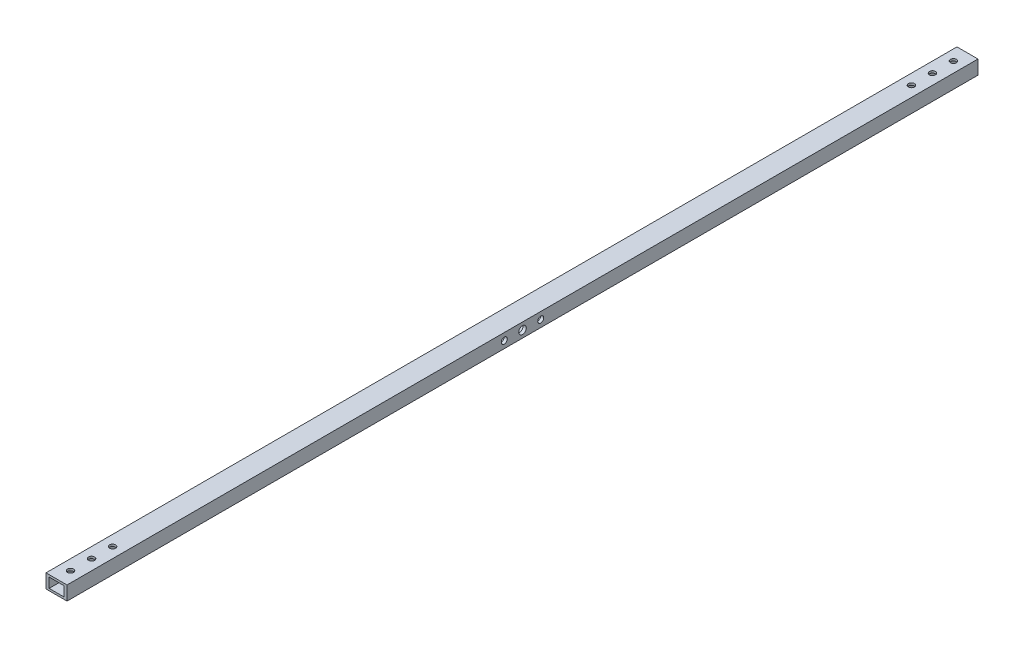
from build123d import *

# Parameters (mm, degrees)
SKETCH_1_W          = 15
SKETCH_1_H          = 10
SKETCH_1_W_2        = 10.5
SKETCH_1_H_2        = 7
EXTRUDE_1_DEPTH     = 650
SKETCH_2_R          = 2.15
CUT_EXTRUDE_1_DEPTH = 651.120181197
SKETCH_3_R          = 2.15
SKETCH_3_R_2        = 2.7
CUT_EXTRUDE_2_DEPTH = 651.192279253


with BuildPart() as part:
    # 草图1 → 凸台-拉伸1 (new body)
    with BuildSketch(Plane.XY):
        Rectangle(SKETCH_1_W, SKETCH_1_H)
        Rectangle(SKETCH_1_W_2, SKETCH_1_H_2, mode=Mode.SUBTRACT)
    extrude(amount=EXTRUDE_1_DEPTH)

    # 草图2 → 切除-拉伸1 (cut, through all)
    with BuildSketch(Plane.XZ.offset(5)):
        with Locations(Location((0, 640, 0), (0, 0, 270))):
            Circle(SKETCH_2_R)
        with Locations(Location((0, 625, 0), (0, 0, 270))):
            Circle(SKETCH_2_R)
        with Locations(Location((0, 610, 0), (0, 0, 270))):
            Circle(SKETCH_2_R)
        with Locations(Location((0, 10, 0), (0, 0, 270))):
            Circle(SKETCH_2_R)
        with Locations(Location((0, 25, 0), (0, 0, 270))):
            Circle(SKETCH_2_R)
        with Locations(Location((0, 40, 0), (0, 0, 270))):
            Circle(SKETCH_2_R)
    extrude(amount=-CUT_EXTRUDE_1_DEPTH, mode=Mode.SUBTRACT)

    # 草图3 → 切除-拉伸2 (cut, through all)
    with BuildSketch(Plane(origin=(7.5, 0, 0), x_dir=(0, 0, -1), z_dir=(1, 0, 0))):
        with Locations((-338, 0)):
            Circle(SKETCH_3_R)
        with Locations((-312, 0)):
            Circle(SKETCH_3_R)
        with Locations((-325, 0)):
            Circle(SKETCH_3_R_2)
    extrude(amount=-CUT_EXTRUDE_2_DEPTH, mode=Mode.SUBTRACT)


solid = part.part
